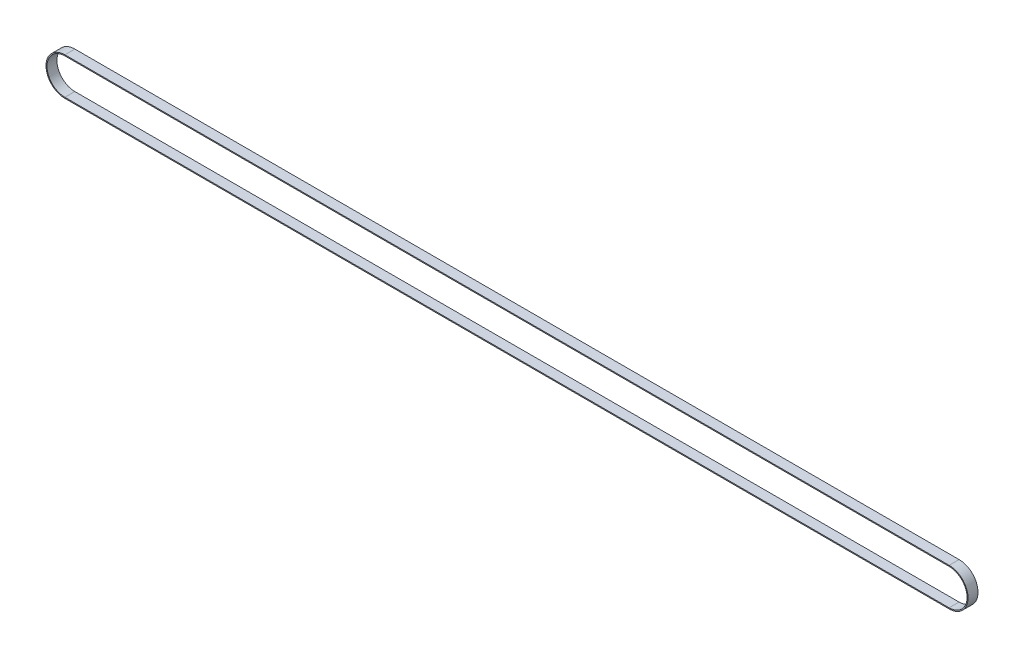
from build123d import *

# Parameters (mm, degrees)
EXTRUDE_1_DEPTH = 10


with BuildPart() as part:
    # 草图1 → 凸台-拉伸1 (new body)
    with BuildSketch(Plane.XY):
        with BuildLine():
            Line((0, -19), (889, -19))
            ThreePointArc((889, -19), (908, 0), (889, 19))
            Line((889, 19), (0, 19))
            ThreePointArc((0, 19), (-19, 0), (0, -19))
        make_face()
        with BuildLine():
            Line((889, 18), (0, 18))
            ThreePointArc((0, 18), (-18, 0), (0, -18))
            Line((0, -18), (889, -18))
            ThreePointArc((889, -18), (907, 0), (889, 18))
        make_face(mode=Mode.SUBTRACT)
    extrude(amount=EXTRUDE_1_DEPTH)


solid = part.part
